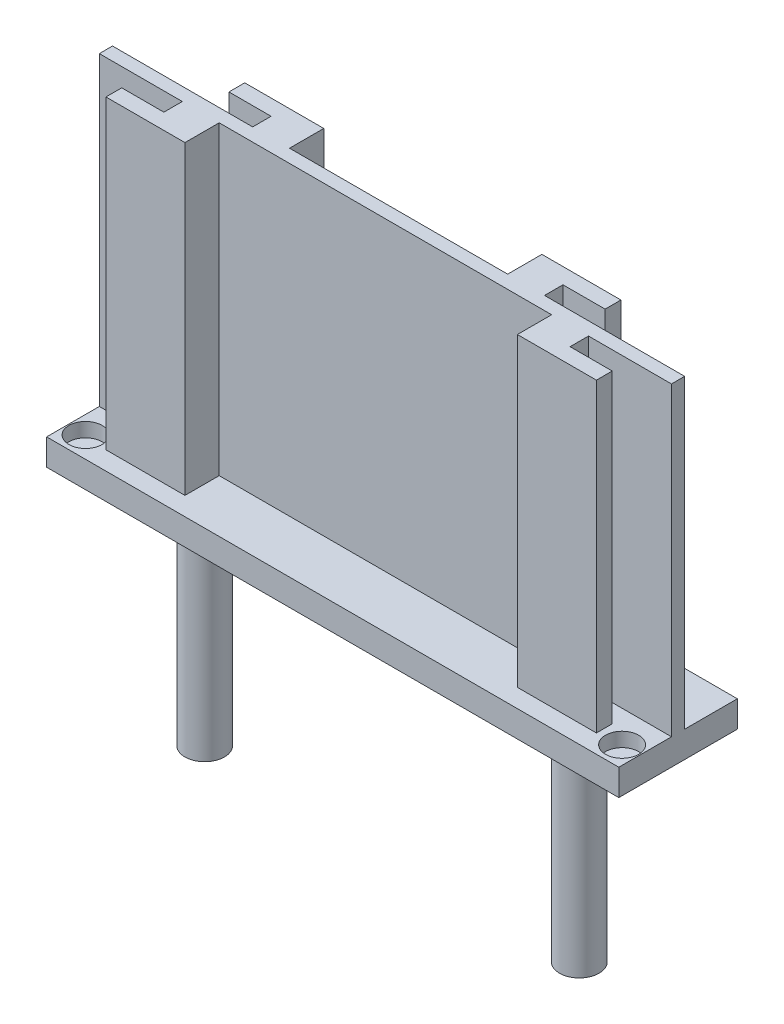
from build123d import *

# Parameters (mm, degrees)
SKETCH1_W           = 108.6
SKETCH1_H           = 22.5
BOSS_EXTRUDE1_DEPTH = 5
SKETCH2_R           = 3.15
CUT_EXTRUDE1_DEPTH  = 2.7
BOSS_EXTRUDE2_DEPTH = 58
SKETCH4_R           = 3.75
SKETCH4_R_2         = 1.5
BOSS_EXTRUDE3_DEPTH = 42
FILLET1_R           = 1


with BuildPart() as part:
    # Sketch1 → Boss-Extrude1 (new body)
    with BuildSketch(Plane(origin=(0, 0, 0), x_dir=(1, 0, 0), z_dir=(0, 1, 0))):
        Rectangle(SKETCH1_W, SKETCH1_H)
    extrude(amount=BOSS_EXTRUDE1_DEPTH)

    # Sketch2 → Cut-Extrude1 (cut)
    with BuildSketch(Plane(origin=(0, 5, 0), x_dir=(1, 0, 0), z_dir=(0, 1, 0))):
        with Locations(Location((50.925, -7.25, 0), (0, 0, 270))):
            Circle(SKETCH2_R)
        with Locations(Location((40.075, 7.25, 0), (0, 0, 270))):
            Circle(SKETCH2_R)
        with Locations(Location((-50.925, -7.25, 0), (0, 0, 270))):
            Circle(SKETCH2_R)
        with Locations(Location((-40.075, 7.25, 0), (0, 0, 270))):
            Circle(SKETCH2_R)
    extrude(amount=-CUT_EXTRUDE1_DEPTH, mode=Mode.SUBTRACT)

    # Sketch3 → Boss-Extrude2 (add)
    with BuildSketch(Plane(origin=(0, 5, 0), x_dir=(1, 0, 0), z_dir=(0, 1, 0))):
        Polygon((-54.3, 1.25), (-54.3, 0), (54.3, 0), (54.3, 1.25), (-20.7, 1.25), (-27.7, 1.25), align=None)
        Polygon((54.3, 0), (-54.3, 0), (-54.3, -1.25), (-38.55, -1.25), (-31.55, -1.25), (54.3, -1.25), align=None)
        Polygon((-31.55, -1.25), (-38.55, -1.25), (-38.55, -4.75), (-46.55, -4.75), (-46.55, -7.75), (-31.55, -7.75), align=None)
        Polygon((-27.7, 4.75), (-27.7, 1.25), (-20.7, 1.25), (-20.7, 7.75), (-35.7, 7.75), (-35.7, 4.75), align=None)
    boss_extrude2 = extrude(amount=BOSS_EXTRUDE2_DEPTH)

    # Mirror1: Boss-Extrude2 across plane
    add(boss_extrude2.mirror(Plane(origin=(0, 0, 0), x_dir=(0, 0, 1), z_dir=(1, 0, 0))))

    # Sketch4 → Boss-Extrude3 (add)
    # profile 1 of 2: a face of its own
    with BuildSketch(Plane.XZ):
        with Locations(Location((-35.55, 0, 0), (0, 0, 270))):
            Circle(SKETCH4_R)
        with Locations(Location((-35.55, 0, 0), (0, 0, 270))):
            Circle(SKETCH4_R_2, mode=Mode.SUBTRACT)
    # profile 2 of 2: a face of its own
    with BuildSketch(Plane.XZ):
        with Locations(Location((35.55, 0, 0), (0, 0, 270))):
            Circle(SKETCH4_R)
        with Locations(Location((35.55, 0, 0), (0, 0, 270))):
            Circle(SKETCH4_R_2, mode=Mode.SUBTRACT)
    extrude(amount=BOSS_EXTRUDE3_DEPTH)

    # Fillet1
    fillet1_edges = [part.edges().sort_by_distance(p)[0] for p in [
        (-35.55, 0, 3.75),
        (35.55, 0, 3.75),
    ]]
    fillet(fillet1_edges, radius=FILLET1_R)


solid = part.part
